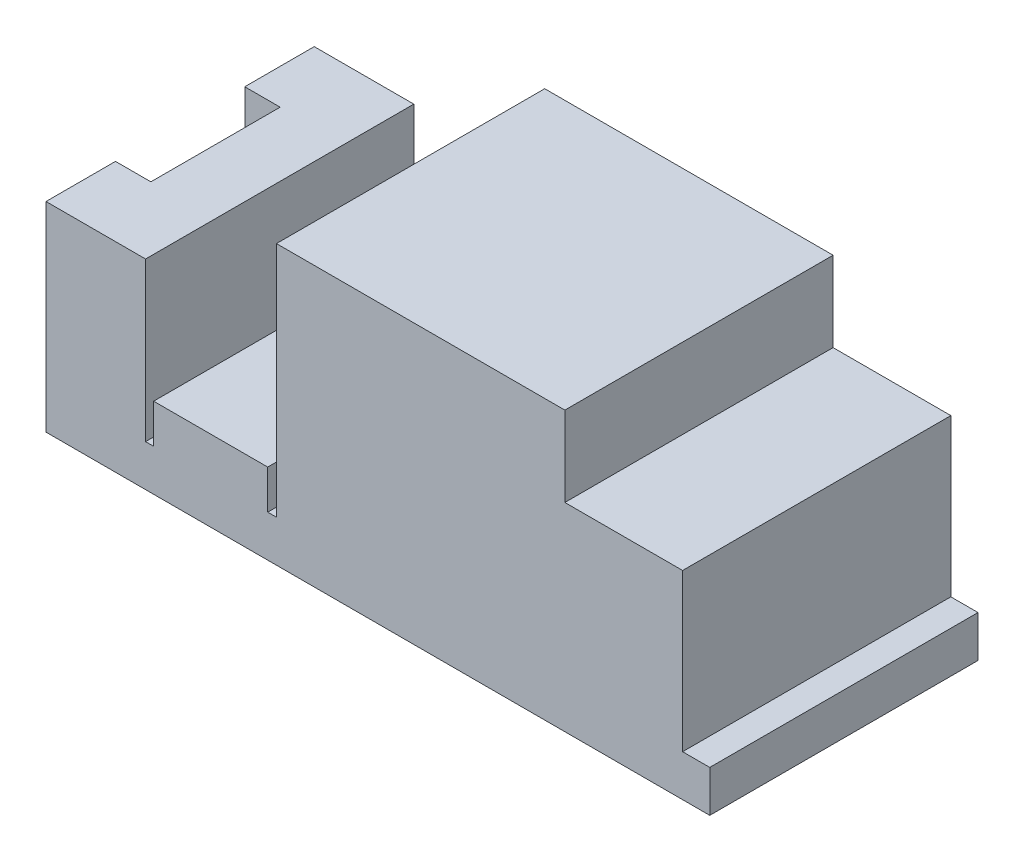
from build123d import *

# Parameters (mm, degrees)
SKETCH1_W           = 43.13
SKETCH1_H           = 17.43
BOSS_EXTRUDE1_DEPTH = 2.7
SKETCH2_W           = 6.47
SKETCH2_H           = 17.43
BOSS_EXTRUDE2_DEPTH = 10.28
SKETCH3_W           = 7.65
SKETCH3_H           = 17.43
BOSS_EXTRUDE3_DEPTH = 10.2
SKETCH4_W           = 18.74
SKETCH4_H           = 17.43
BOSS_EXTRUDE4_DEPTH = 15.4
SKETCH5_W           = 7.411125452
SKETCH5_H           = 17.43
BOSS_EXTRUDE5_DEPTH = 2.54
SKETCH6_W           = 8.4
SKETCH6_H           = 10.28
CUT_EXTRUDE1_DEPTH  = 2.3


with BuildPart() as part:
    # Sketch1 → Boss-Extrude1 (new body)
    with BuildSketch(Plane(origin=(0, 0, 0), x_dir=(1, 0, 0), z_dir=(0, 1, 0))):
        Rectangle(SKETCH1_W, SKETCH1_H)
    extrude(amount=-BOSS_EXTRUDE1_DEPTH)

    # Sketch2 → Boss-Extrude2 (add)
    with BuildSketch(Plane(origin=(0, 0, 0), x_dir=(1, 0, 0), z_dir=(0, 1, 0))):
        with Locations((-18.33, 0)):
            Rectangle(SKETCH2_W, SKETCH2_H)
    extrude(amount=BOSS_EXTRUDE2_DEPTH)

    # Sketch3 → Boss-Extrude3 (add)
    with BuildSketch(Plane(origin=(0, 0, 0), x_dir=(1, 0, 0), z_dir=(0, 1, 0))):
        with Locations((15.975212475, 0)):
            Rectangle(SKETCH3_W, SKETCH3_H)
    extrude(amount=BOSS_EXTRUDE3_DEPTH)

    # Sketch4 → Boss-Extrude4 (add)
    with BuildSketch(Plane(origin=(0, 0, 0), x_dir=(1, 0, 0), z_dir=(0, 1, 0))):
        with Locations((2.780212475, 0)):
            Rectangle(SKETCH4_W, SKETCH4_H)
    extrude(amount=BOSS_EXTRUDE4_DEPTH)

    # Sketch5 → Boss-Extrude5 (add)
    with BuildSketch(Plane(origin=(0, 0, 0), x_dir=(1, 0, 0), z_dir=(0, 1, 0))):
        with Locations((-10.86460908, 0)):
            Rectangle(SKETCH5_W, SKETCH5_H)
    extrude(amount=BOSS_EXTRUDE5_DEPTH)

    # Sketch6 → Cut-Extrude1 (cut)
    with BuildSketch(Plane.ZY.offset(21.565)):
        with Locations((0, 5.14)):
            Rectangle(SKETCH6_W, SKETCH6_H)
    extrude(amount=-CUT_EXTRUDE1_DEPTH, mode=Mode.SUBTRACT)


solid = part.part
